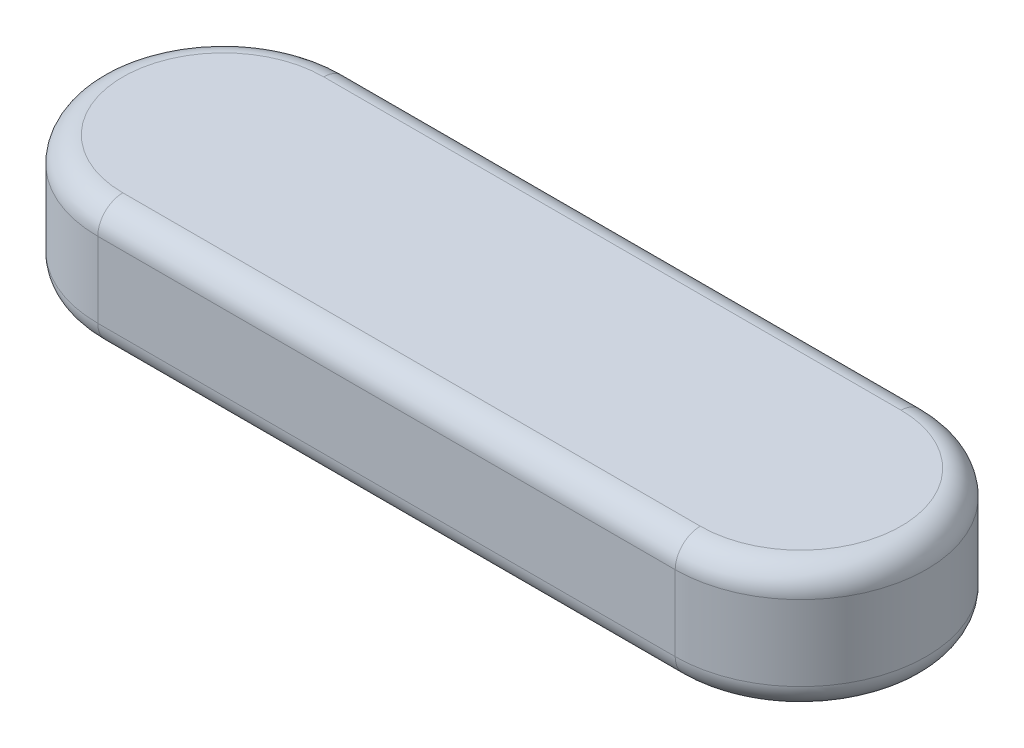
from build123d import *

# Parameters (mm, degrees)
BOSS_EXTRUDE1_DEPTH = 5
FILLET1_R           = 1


with BuildPart() as part:
    # Sketch2 → Boss-Extrude1 (new body)
    with BuildSketch(Plane(origin=(0, 0, 0), x_dir=(1, 0, 0), z_dir=(0, 1, 0))):
        with BuildLine():
            Line((-11.5, 5), (11.5, 5))
            ThreePointArc((11.5, 5), (16.5, 0), (11.5, -5))
            Line((11.5, -5), (-11.5, -5))
            ThreePointArc((-11.5, -5), (-16.5, 0), (-11.5, 5))
        make_face()
    extrude(amount=BOSS_EXTRUDE1_DEPTH)

    # Fillet1
    fillet1_edges = [part.edges().sort_by_distance(p)[0] for p in [
        (16.5, 5, 0),
        (0, 5, -5),
        (-16.5, 5, 0),
        (0, 0, -5),
        (16.5, 0, 0),
        (0, 0, 5),
        (-16.5, 0, 0),
        (0, 5, 5),
    ]]
    fillet(fillet1_edges, radius=FILLET1_R)


solid = part.part
